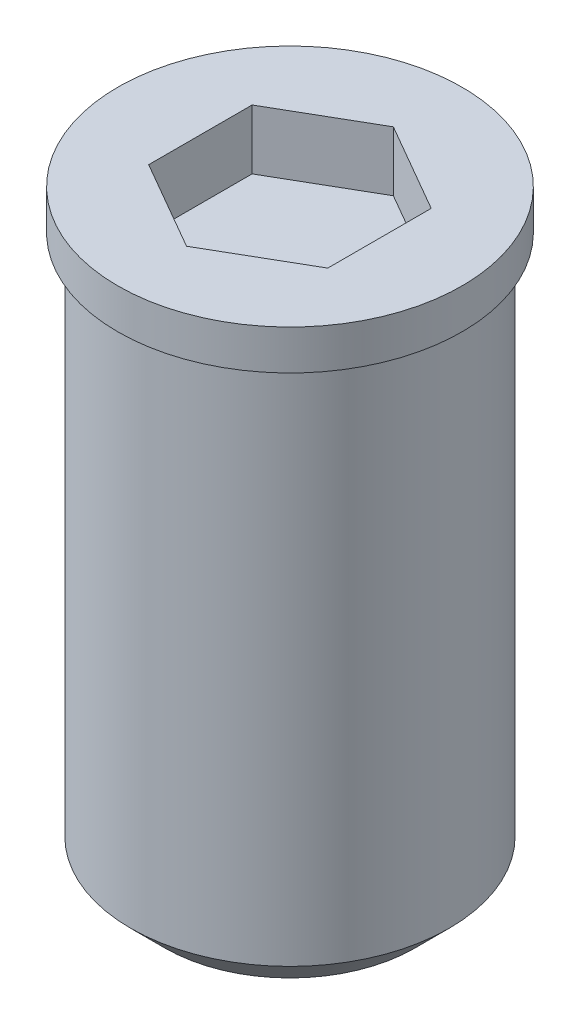
from build123d import *

# Parameters (mm, degrees)
CUT_EXTRUDE_1_DEPTH = 0.75


with BuildPart() as part:
    # Эскиз1 → Повернуть1 (revolve)
    with BuildSketch(Plane.XY, mode=Mode.PRIVATE) as revolve_1_sk:
        Polygon((0, 0.5), (2.162162162, 0.5), (2.162162162, 0), (2, 0), (2, -6.5705), (1.5705, -7), (0, -7), align=None)
    revolve(revolve_1_sk.sketch.rotate(Axis((0, -7, 0), (0, 1, 0)), 270), axis=Axis((0, -7, 0), (0, 1, 0)))

    # Эскиз2 → Вырез-Вытянуть1 (cut)
    with BuildSketch(Plane(origin=(0, 0.5, 0), x_dir=(1, 0, 0), z_dir=(0, 1, 0))):
        Polygon((-1.125, 0.649519053), (-1.125, -0.649519053), (0, -1.299038106), (1.125, -0.649519053), (1.125, 0.649519053), (0, 1.299038106), align=None)
    extrude(amount=-CUT_EXTRUDE_1_DEPTH, mode=Mode.SUBTRACT)


solid = part.part
